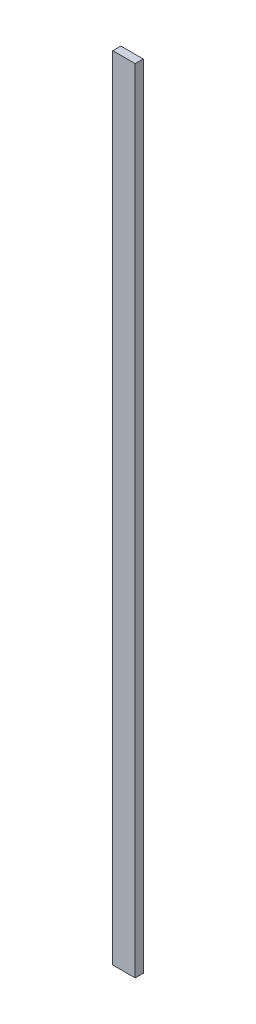
from build123d import *

# Parameters (mm, degrees)
SKETCH1_W           = 50.8
SKETCH1_H           = 1792.2875
BOSS_EXTRUDE1_DEPTH = 18.25625


with BuildPart() as part:
    # Sketch1 → Boss-Extrude1 (new body)
    with BuildSketch(Plane.XY):
        Rectangle(SKETCH1_W, SKETCH1_H)
    extrude(amount=BOSS_EXTRUDE1_DEPTH)


solid = part.part
